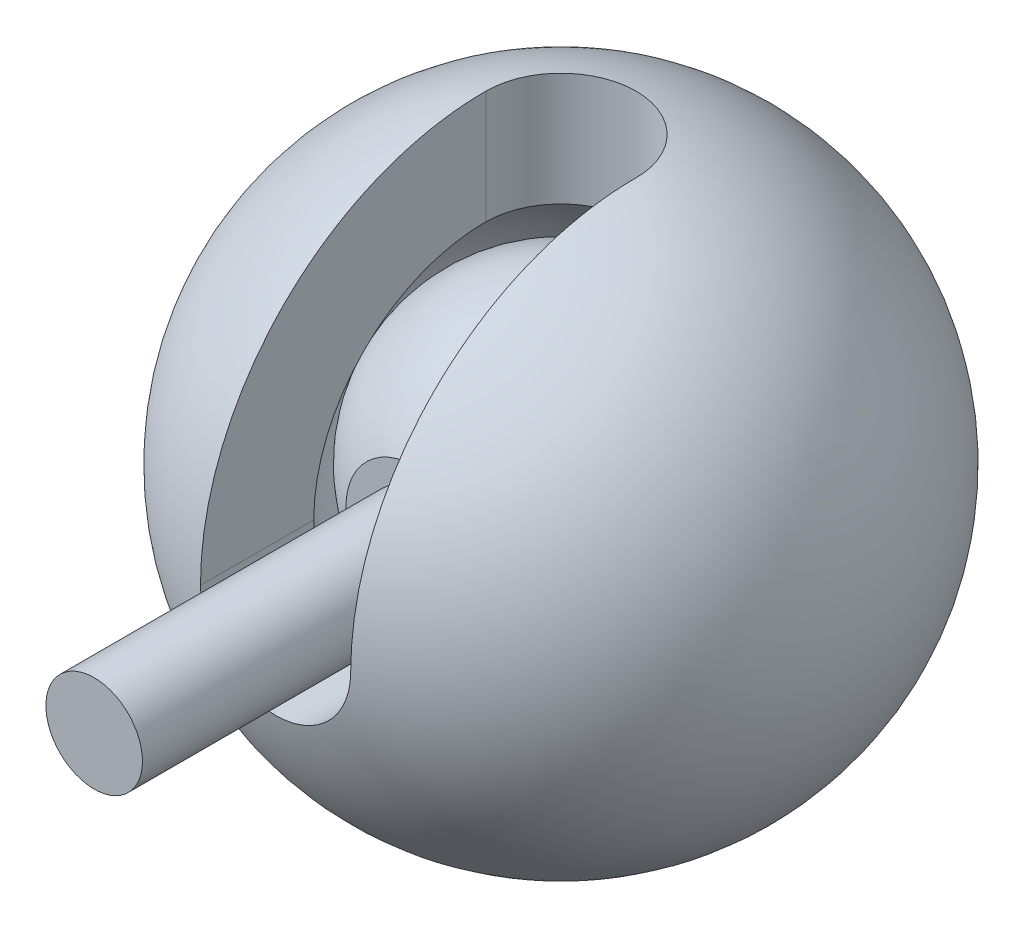
from build123d import *

# Parameters (mm, degrees)
SKETCH4_R           = 3.5
CUT_EXTRUDE3_DEPTH  = 7
SKETCH12_W          = 7
SKETCH12_H          = 11.910081264
SKETCH13_R          = 3.5
CUT_EXTRUDE4_DEPTH  = 6
SKETCH14_R          = 2.25
BOSS_EXTRUDE3_DEPTH = 15


with BuildPart() as part:
    # Sketch1 → Revolve1 (revolve)
    with BuildSketch(Plane.XY):
        with BuildLine():
            Line((0, 7.5), (0, -7.5))
            ThreePointArc((0, -7.5), (-7.5, 0), (0, 7.5))
        make_face()
    revolve(axis=Axis((0, -7.5, 0), (0, 1, 0)))


with BuildPart() as body_2:
    # Sketch2 → Revolve-Thin2 (revolve)
    with BuildSketch(Plane.XY):
        with BuildLine():
            ThreePointArc((0, 8.75), (-8.75, 0), (0, -8.75))
            Line((0, -8.75), (0, -13.75))
            ThreePointArc((0, -13.75), (-13.75, 0), (0, 13.75))
            Line((0, 13.75), (0, 8.75))
        make_face()
    revolve(axis=Axis((0, 7.5, 0), (0, -1, 0)))


with BuildPart() as cut_extrude3_tool:
    # Sketch4 → Cut-Extrude3 (new body)
    with BuildSketch(Plane.XY.offset(13.75)):
        with Locations(Location((0, 0, 0), (0, 0, 180))):
            Circle(SKETCH4_R)
    extrude(amount=-CUT_EXTRUDE3_DEPTH)


with BuildPart() as part_1:
    add(part.part)

    # Cut-Extrude3: cut by cut_extrude3_tool
    add(cut_extrude3_tool.part, mode=Mode.SUBTRACT)

    # Sketch14 → Boss-Extrude3 (add)
    with BuildSketch(Plane.XY.offset(6.75)):
        Circle(SKETCH14_R)
    extrude(amount=BOSS_EXTRUDE3_DEPTH)


with BuildPart() as body_2_1:
    add(body_2.part)

    # Cut-Extrude3: cut by cut_extrude3_tool
    add(cut_extrude3_tool.part, mode=Mode.SUBTRACT)

    # Cut-Sweep2: sweep along a path in Sketch11
    with BuildLine(Plane(origin=(0, 0, 0), x_dir=(0, 0, -1), z_dir=(1, 0, 0))) as cut_sweep2_path:
        ThreePointArc((0, 13.75), (-9.722718241, 9.722718241), (-13.75, 0))
    # Sketch12 → Cut-Sweep2 (sweep, cut)
    with BuildSketch(Plane(origin=(0, 0, 0), x_dir=(1, 0, 0), z_dir=(0, 1, 0))):
        with Locations((0, -13.75)):
            Rectangle(SKETCH12_W, SKETCH12_H)
    sweep(path=cut_sweep2_path.line, mode=Mode.SUBTRACT)

    # Sketch13 → Cut-Extrude4 (cut)
    with BuildSketch(Plane(origin=(0, 13.75, 0), x_dir=(1, 0, 0), z_dir=(0, 1, 0))):
        Circle(SKETCH13_R)
    extrude(amount=-CUT_EXTRUDE4_DEPTH, mode=Mode.SUBTRACT)


solid = Compound([part_1.part, body_2_1.part])
